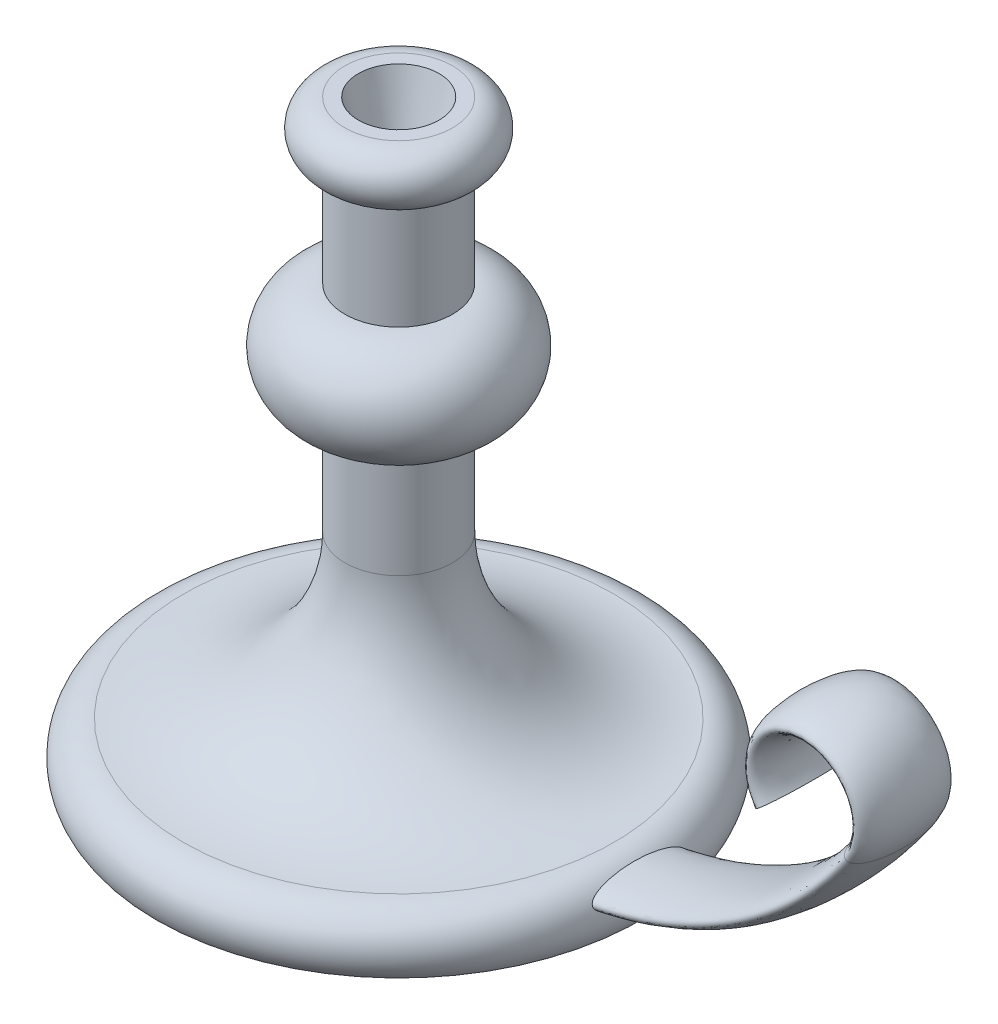
from build123d import *

# Parameters (mm, degrees)
SKETCH3_RX         = 17.5
SKETCH3_RY         = 5
SKETCH7_R          = 15
CUT_EXTRUDE1_DEPTH = 25
CUT_EXTRUDE1_DRAFT = -15


with BuildPart() as part:
    # Sketch1 → Revolve1 (revolve)
    with BuildSketch(Plane.XY, mode=Mode.PRIVATE) as revolve1_sk:
        with BuildLine():
            Line((0, 0), (0, 220))
            Line((0, 220), (20, 220))
            ThreePointArc((20, 220), (30, 210), (20, 200))
            Line((20, 200), (20, 160))
            ThreePointArc((20, 160), (40, 140), (20, 120))
            Line((20, 120), (20, 80))
            ThreePointArc((20, 80), (37.573593129, 37.573593129), (80, 20))
            ThreePointArc((80, 20), (91.180339887, 13.090169944), (90, 0))
            Line((90, 0), (0, 0))
        make_face()
    revolve(revolve1_sk.sketch.rotate(Axis((0, 0, 0), (0, 1, 0)), 90), axis=Axis((0, 0, 0), (0, 1, 0)))

    # Sweep1: sweep along a path in Path
    with BuildLine(Plane.XY) as sweep1_path:
        Line((0, 10), (60, 10))
        ThreePointArc((60, 10), (129.821200219, 27.240819526), (183.592070943, 75))
        ThreePointArc((183.592070943, 75), (167.113128151, 106.333333333), (150.634185358, 75))
    # Sketch3 → Sweep1 (sweep)
    with BuildSketch(Plane(origin=(0, 0, 0), x_dir=(0, 0, -1), z_dir=(1, 0, 0))):
        with Locations((0, 10)):
            Ellipse(SKETCH3_RX, SKETCH3_RY)
    sweep(path=sweep1_path.line)


with BuildPart() as cut_extrude1_tool:
    # Sketch7 → Cut-Extrude1 (with draft: the straight prism first)
    with BuildSketch(Plane(origin=(0, 220, 0), x_dir=(1, 0, 0), z_dir=(0, 1, 0))):
        Circle(SKETCH7_R)
    extrude(amount=-CUT_EXTRUDE1_DEPTH)
    # Cut-Extrude1: the draft: its side faces are tilted about the plane it starts from
    cut_extrude1_sides = [cut_extrude1_tool.faces().sort_by_distance(p)[0] for p in [
        (-15, 207.5, 0),
    ]]
    draft(cut_extrude1_sides, Plane(origin=(0, 220, 0), x_dir=(1, 0, 0), z_dir=(0, 1, 0)), CUT_EXTRUDE1_DRAFT)


with BuildPart() as part_1:
    add(part.part)

    # Cut-Extrude1: cut by cut_extrude1_tool
    add(cut_extrude1_tool.part, mode=Mode.SUBTRACT)


solid = part_1.part
